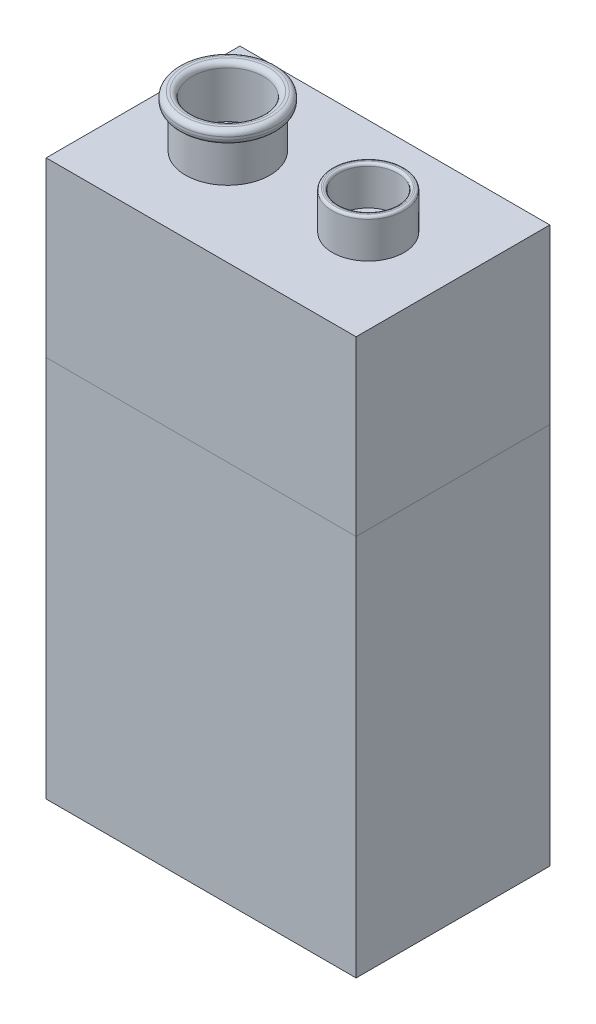
from build123d import *

# Parameters (mm, degrees)
CROQUIS1_W              = 24
CROQUIS1_H              = 15
SALIENTE_EXTRUIR1_DEPTH = 43
CROQUIS2_R              = 2.771687151
CROQUIS2_R_2            = 2.271687151
CROQUIS2_R_3            = 3.271687151
SALIENTE_EXTRUIR2_DEPTH = 3
CROQUIS3_R              = 3.771687151
CROQUIS3_R_2            = 2.771687151
SALIENTE_EXTRUIR3_DEPTH = 1
REDONDEO1_R             = 0.4
REDONDEO2_R             = 0.2


with BuildPart() as part:
    # Croquis1 → Saliente-Extruir1 (new body)
    with BuildSketch(Plane(origin=(0, 0, 0), x_dir=(1, 0, 0), z_dir=(0, 1, 0))):
        with Locations((12, 7.5)):
            Rectangle(CROQUIS1_W, CROQUIS1_H)
    extrude(amount=SALIENTE_EXTRUIR1_DEPTH)

    # Croquis2 → Saliente-Extruir2 (add)
    # profile 1 of 2: a face of its own
    with BuildSketch(Plane(origin=(0, 43, 0), x_dir=(1, 0, 0), z_dir=(0, 1, 0))):
        with Locations(Location((17.438401582, 7.5, 0), (0, 0, 90))):
            Circle(CROQUIS2_R)
        with Locations(Location((17.438401582, 7.5, 0), (0, 0, 90))):
            Circle(CROQUIS2_R_2, mode=Mode.SUBTRACT)
    # profile 2 of 2: a face of its own
    with BuildSketch(Plane(origin=(0, 43, 0), x_dir=(1, 0, 0), z_dir=(0, 1, 0))):
        with Locations(Location((6.561598418, 7.5, 0), (0, 0, 90))):
            Circle(CROQUIS2_R_3)
        with Locations(Location((6.561598418, 7.5, 0), (0, 0, 270))):
            Circle(CROQUIS2_R, mode=Mode.SUBTRACT)
    extrude(amount=SALIENTE_EXTRUIR2_DEPTH)

    # Croquis3 → Saliente-Extruir3 (add)
    with BuildSketch(Plane(origin=(0, 46, 0), x_dir=(1, 0, 0), z_dir=(0, 1, 0))):
        with Locations(Location((6.561598418, 7.5, 0), (0, 0, 270))):
            Circle(CROQUIS3_R)
        with Locations(Location((6.561598418, 7.5, 0), (0, 0, 270))):
            Circle(CROQUIS3_R_2, mode=Mode.SUBTRACT)
    extrude(amount=SALIENTE_EXTRUIR3_DEPTH)

    # Redondeo1
    redondeo1_edges = [part.edges().sort_by_distance(p)[0] for p in [
        (6.561598418, 47, -11.271687151),
        (6.561598418, 46, -11.271687151),
        (6.561598418, 47, -10.271687151),
    ]]
    fillet(redondeo1_edges, radius=REDONDEO1_R)

    # Redondeo2
    redondeo2_edges = [part.edges().sort_by_distance(p)[0] for p in [
        (17.438401582, 46, -4.728312849),
        (17.438401582, 46, -5.228312849),
    ]]
    fillet(redondeo2_edges, radius=REDONDEO2_R)


solid = part.part
